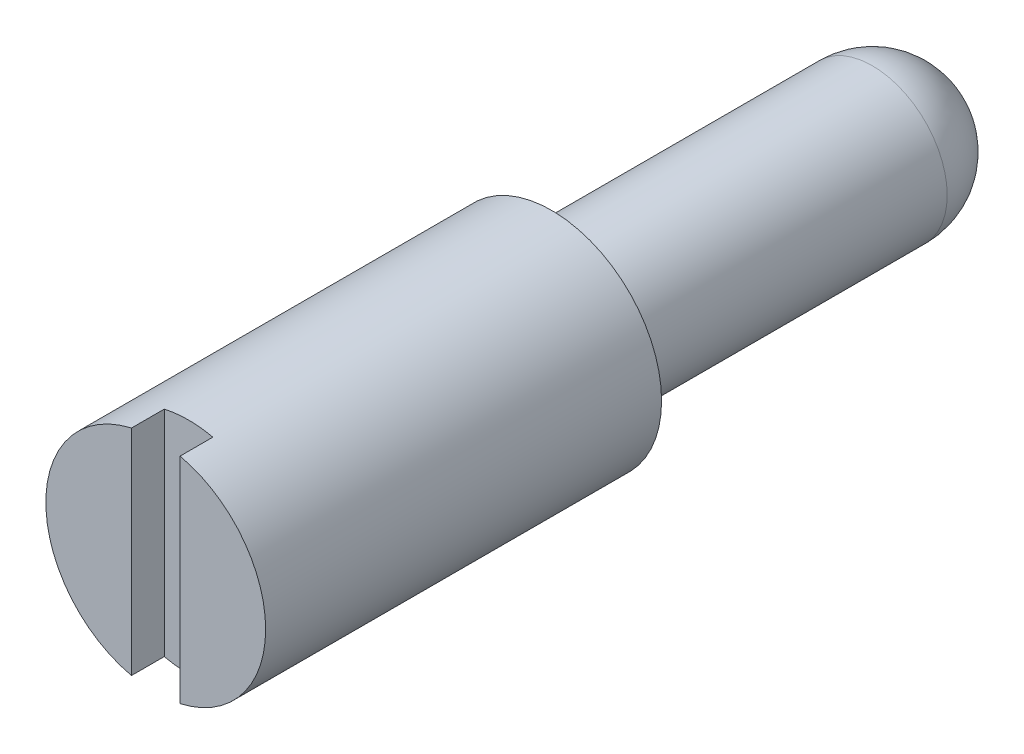
from build123d import *

# Parameters (mm, degrees)
CUT_EXTRUDE2_DEPTH      = 20.413875706
CUT_EXTRUDE2_DEPTH_BACK = 20.413875706
SKETCH2_W               = 1.17
SKETCH2_H               = 0.79


with BuildPart() as part:
    # Sketch1 → Revolve1 (revolve)
    with BuildSketch(Plane(origin=(0, 0, 0), x_dir=(1, 0, 0), z_dir=(0, 1, 0))):
        with BuildLine():
            Line((0, 0), (2.645379929, 0))
            Line((2.645379929, 0), (2.645379929, 9.53))
            Line((2.645379929, 9.53), (1.8, 9.53))
            Line((1.8, 9.53), (1.8, 17.25))
            ThreePointArc((1.8, 17.25), (1.272792206, 18.522792206), (0, 19.05))
            Line((0, 19.05), (0, 0))
        make_face()
    revolve(axis=Axis((0, 0, 0), (0, 0, -1)))

    # Sketch2 → Cut-Extrude2 (cut, two sides: drawn at the far end of the back side and taken through both)
    with BuildSketch(Plane(origin=(0, 0, 0), x_dir=(1, 0, 0), z_dir=(0, 1, 0)).offset(-CUT_EXTRUDE2_DEPTH_BACK)):
        with Locations((0, 0.395)):
            Rectangle(SKETCH2_W, SKETCH2_H)
    extrude(amount=CUT_EXTRUDE2_DEPTH + CUT_EXTRUDE2_DEPTH_BACK, mode=Mode.SUBTRACT)


solid = part.part
